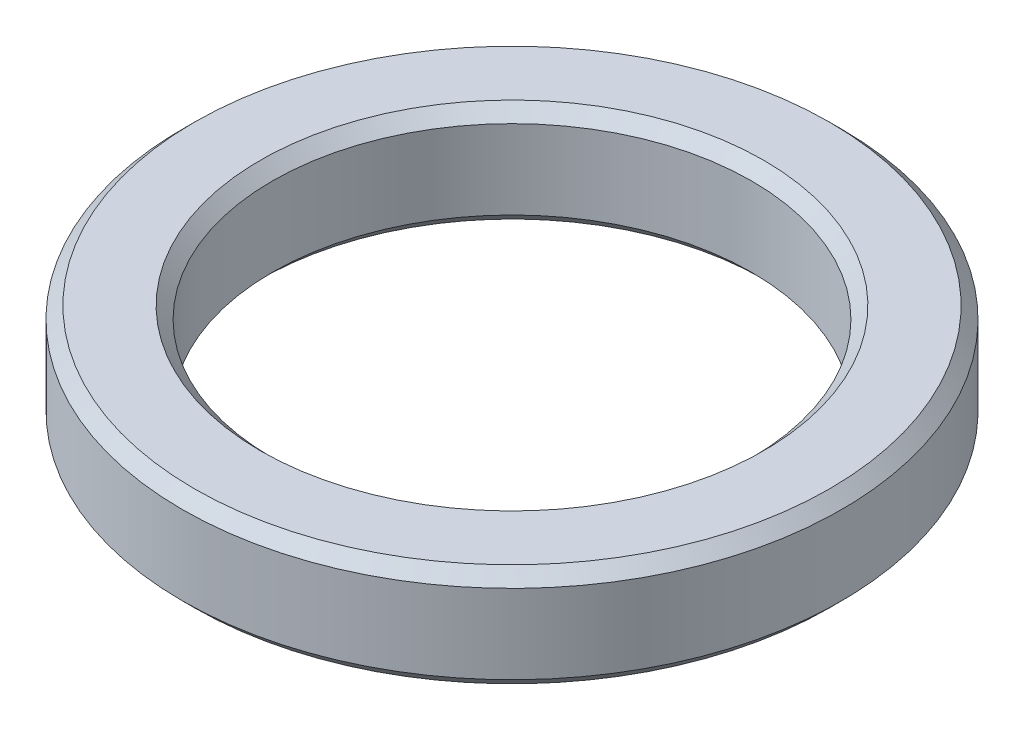
from build123d import *

# Parameters (mm, degrees)
SKIZZE1_R                       = 2.75
SKIZZE1_R_2                     = 2
AUFSATZ_LINEAR_AUSTRAGEN1_DEPTH = 0.86
FASE1_SIZE                      = 0.1


with BuildPart() as part:
    # Skizze1 → Aufsatz-Linear austragen1 (new body)
    with BuildSketch(Plane(origin=(0, 0, 0), x_dir=(1, 0, 0), z_dir=(0, 1, 0))):
        Circle(SKIZZE1_R)
        Circle(SKIZZE1_R_2, mode=Mode.SUBTRACT)
    extrude(amount=AUFSATZ_LINEAR_AUSTRAGEN1_DEPTH)

    # Fase1
    fase1_edges = [part.edges().sort_by_distance(p)[0] for p in [
        (-2, 0, 0),
        (-2.75, 0, 0),
        (-2, 0.86, 0),
        (-2.75, 0.86, 0),
    ]]
    chamfer(fase1_edges, length=FASE1_SIZE)


solid = part.part
